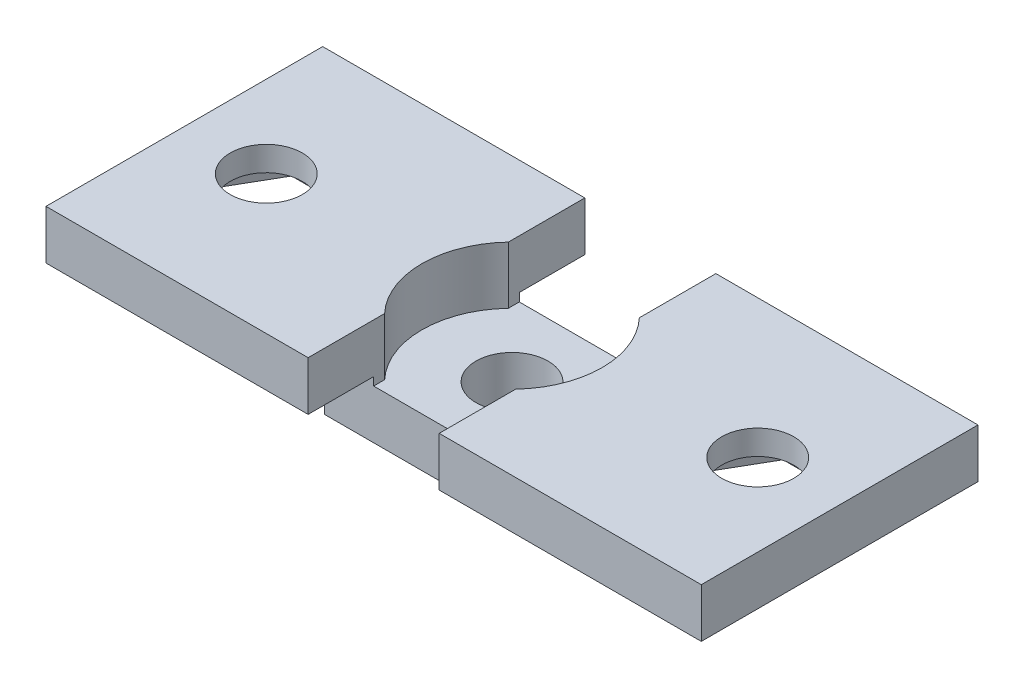
from build123d import *

# Parameters (mm, degrees)
SKETCH1_W           = 40
SKETCH1_H           = 8.89
SKETCH1_R           = 2.2
BOSS_EXTRUDE1_DEPTH = 6.5
CUT_EXTRUDE1_REACH  = 24.832
SKETCH2_W           = 8
SKETCH2_H           = 3.5
SKETCH2_W_2         = 13
SKETCH3_R           = 5.5
CUT_EXTRUDE2_DEPTH  = 3.5
CUT_EXTRUDE3_DEPTH  = 1.5
SKETCH6_W           = 16
SKETCH6_H           = 3
BOSS_EXTRUDE2_DEPTH = 4


with BuildPart() as part:
    # Sketch1 → Boss-Extrude1 (new body)
    with BuildSketch(Plane(origin=(0, 0, 0), x_dir=(1, 0, 0), z_dir=(0, 1, 0))):
        Rectangle(SKETCH1_W, SKETCH1_H)
        with Locations(Location((0, 0, 0), (0, 0, 90))):
            Circle(SKETCH1_R, mode=Mode.SUBTRACT)
        with Locations(Location((-15, 0, 0), (0, 0, 90))):
            Circle(SKETCH1_R, mode=Mode.SUBTRACT)
        with Locations(Location((15, 0, 0), (0, 0, 90))):
            Circle(SKETCH1_R, mode=Mode.SUBTRACT)
    extrude(amount=BOSS_EXTRUDE1_DEPTH)

    # Cut-Extrude1: up to this face of the body (flat: up to its plane)
    cut_extrude1_end = Plane(part.part.faces().sort_by_distance((0, 3.25, -4.445))[0])
    # Sketch2 → Cut-Extrude1 (cut, up to the picked face)
    with BuildSketch(Plane.XY.offset(4.445), mode=Mode.PRIVATE) as cut_extrude1_sk1:
        with Locations((0, 4.75)):
            Rectangle(SKETCH2_W, SKETCH2_H)
    cut_extrude1_tool1 = split(extrude(cut_extrude1_sk1.sketch, amount=-CUT_EXTRUDE1_REACH, mode=Mode.PRIVATE), bisect_by=cut_extrude1_end, keep=Keep.BOTH, mode=Mode.PRIVATE)
    # Sketch2 → Cut-Extrude1 (cut, up to the picked face)
    with BuildSketch(Plane.XY.offset(4.445), mode=Mode.PRIVATE) as cut_extrude1_sk2:
        with Locations((-13.5, 1.75)):
            Rectangle(SKETCH2_W_2, SKETCH2_H)
    cut_extrude1_tool2 = split(extrude(cut_extrude1_sk2.sketch, amount=-CUT_EXTRUDE1_REACH, mode=Mode.PRIVATE), bisect_by=cut_extrude1_end, keep=Keep.BOTH, mode=Mode.PRIVATE)
    # Sketch2 → Cut-Extrude1 (cut, up to the picked face)
    with BuildSketch(Plane.XY.offset(4.445), mode=Mode.PRIVATE) as cut_extrude1_sk3:
        with Locations((13.5, 1.75)):
            Rectangle(SKETCH2_W_2, SKETCH2_H)
    cut_extrude1_tool3 = split(extrude(cut_extrude1_sk3.sketch, amount=-CUT_EXTRUDE1_REACH, mode=Mode.PRIVATE), bisect_by=cut_extrude1_end, keep=Keep.BOTH, mode=Mode.PRIVATE)
    add(cut_extrude1_tool1.solids().sort_by(Axis((0, 4.75, 4.445), (0, 0, -1)))[0], mode=Mode.SUBTRACT)
    add(cut_extrude1_tool2.solids().sort_by(Axis((-13.5, 1.75, 4.445), (0, 0, -1)))[0], mode=Mode.SUBTRACT)
    add(cut_extrude1_tool3.solids().sort_by(Axis((13.5, 1.75, 4.445), (0, 0, -1)))[0], mode=Mode.SUBTRACT)

    # Sketch3 → Cut-Extrude2 (cut)
    with BuildSketch(Plane(origin=(0, 3, 0), x_dir=(1, 0, 0), z_dir=(0, 1, 0))):
        Circle(SKETCH3_R)
    extrude(amount=CUT_EXTRUDE2_DEPTH, mode=Mode.SUBTRACT)

    # Sketch4 → Cut-Extrude3 (cut)
    with BuildSketch(Plane(origin=(0, 3.5, 0), x_dir=(-1, 0, 0), z_dir=(0, -1, 0))):
        Polygon((12.892671517, 3.65), (10.785343035, 0), (12.892671517, -3.65), (17.107328483, -3.65), (19.214656965, 0), (17.107328483, 3.65), align=None)
        Polygon((-17.107328483, 3.65), (-19.214656965, 0), (-17.107328483, -3.65), (-12.892671517, -3.65), (-10.785343035, 0), (-12.892671517, 3.65), align=None)
    extrude(amount=-CUT_EXTRUDE3_DEPTH, mode=Mode.SUBTRACT)

    # Sketch6 → Boss-Extrude2 (add)
    with BuildSketch(Plane.XY.offset(4.445)):
        with Locations((-12, 5)):
            Rectangle(SKETCH6_W, SKETCH6_H)
        with Locations((12, 5)):
            Rectangle(SKETCH6_W, SKETCH6_H)
    boss_extrude2 = extrude(amount=BOSS_EXTRUDE2_DEPTH)

    # Mirror1: Boss-Extrude2 across plane
    add(boss_extrude2.mirror(Plane.XY))


solid = part.part
